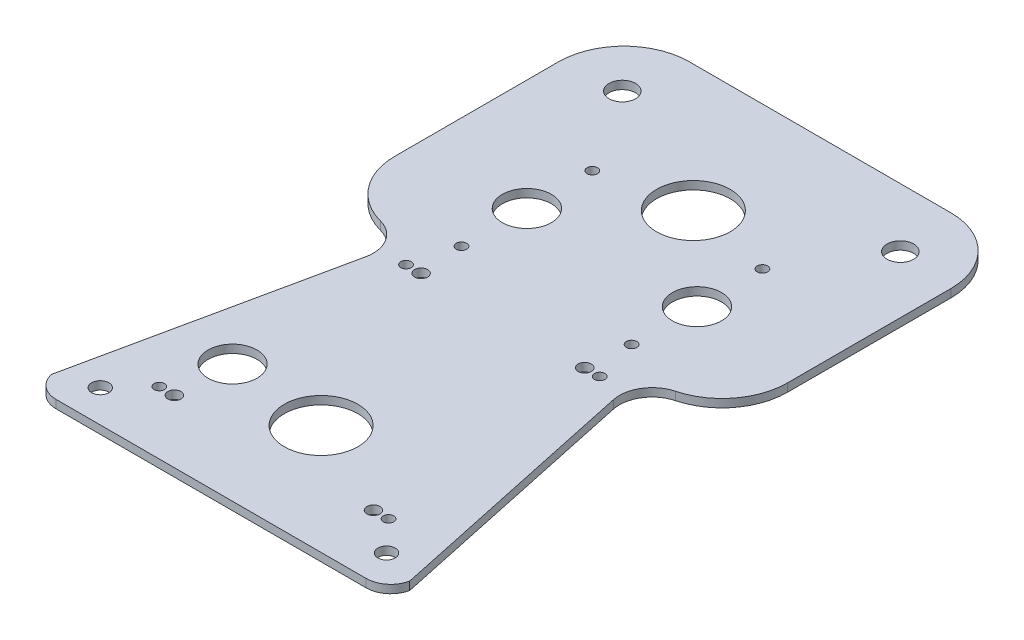
from build123d import *

# Parameters (mm, degrees)
SKETCH1_W                  = 355.6
SKETCH1_H                  = 77.724
BOSS_EXTRUDE1_DEPTH        = 22.225
SKETCH2_W                  = 74.549
SKETCH2_H                  = 19.05
CUT_EXTRUDE1_DEPTH         = 364.67400769
SKETCH3_W                  = 25.4
SKETCH3_H                  = 3.937
CUT_EXTRUDE2_DEPTH         = 817.444922817
SKETCH4_W                  = 330.2
SKETCH4_H                  = 3.175
BOSS_EXTRUDE2_DEPTH        = 15.875
SKETCH5_W                  = 69.85
SKETCH5_H                  = 3.175
BOSS_EXTRUDE3_DEPTH        = 457.2
SKETCH6_W                  = 330.2
SKETCH6_H                  = 3.175
BOSS_EXTRUDE4_DEPTH        = 3.937
SKETCH7_W                  = 330.2
SKETCH7_H                  = 3.175
BOSS_EXTRUDE5_DEPTH        = 15.875
SKETCH8_W                  = 355.6
SKETCH8_H                  = 3.175
BOSS_EXTRUDE6_DEPTH        = 3.937
SKETCH9_W                  = 355.6
SKETCH9_H                  = 3.175
BOSS_EXTRUDE7_DEPTH        = 19.05
SKETCH10_W                 = 76.358809824
SKETCH10_H                 = 3.175
BOSS_EXTRUDE8_DEPTH        = 27.432
SKETCH11_W                 = 124.052954744
SKETCH11_H                 = 3.175
BOSS_EXTRUDE9_DEPTH        = 19.05
DRAFT1_ANGLE               = 30
DRAFT2_ANGLE               = 19
M20_CLEARANCE_HOLE1_D      = 22.225
M20_CLEARANCE_HOLE1_DEPTH  = 19.050025
HOLE1_D                    = 8.128
HOLE1_DEPTH                = 22.225
M25_CLEARANCE_HOLE1_D      = 28.575
M25_CLEARANCE_HOLE1_DEPTH  = 22.225
M3_CLEARANCE_HOLE1_D       = 3.571875
M3_CLEARANCE_HOLE1_DEPTH   = 22.225
M2_CLEARANCE_HOLE1_D       = 2.54
M2_CLEARANCE_HOLE1_DEPTH   = 22.225
M3_5_CLEARANCE_HOLE1_D     = 4.064
M3_5_CLEARANCE_HOLE1_DEPTH = 22.225
HOLE2_D                    = 5.08
HOLE2_DEPTH                = 22.225
M25_CLEARANCE_HOLE2_D      = 28.575
M25_CLEARANCE_HOLE2_DEPTH  = 19.050025
HOLE3_D                    = 5.1054
HOLE3_DEPTH                = 19.050025
HOLE4_D                    = 8.128
HOLE4_DEPTH                = 19.050025
M3_CLEARANCE_HOLE2_D       = 3.571875
M3_CLEARANCE_HOLE2_DEPTH   = 19.050025
M6_CLEARANCE_HOLE1_D       = 6.7056
M6_CLEARANCE_HOLE1_DEPTH   = 22.225
M6_CLEARANCE_HOLE2_D       = 6.7056
M6_CLEARANCE_HOLE2_DEPTH   = 101.219
M5_CLEARANCE_HOLE1_D       = 5.334
M5_CLEARANCE_HOLE1_DEPTH   = 92.837
CHAMFER1_SIZE              = 3.175
FILLET1_R                  = 0.762
FILLET2_R                  = 3.175
FILLET3_R                  = 3.937
CUT_EXTRUDE3_DEPTH         = 819.902667079
CUT_EXTRUDE3_DEPTH_BACK    = 819.902667079
BOSS_EXTRUDE10_DEPTH       = 3.175
BOSS_EXTRUDE11_DEPTH       = 3.175
FILLET4_R                  = 25.4
FILLET5_R                  = 12.7
SKETCH47_R                 = 14.2875
SKETCH47_R_2               = 8.5
SKETCH47_R_3               = 9.525
SKETCH47_R_4               = 2.032
CUT_EXTRUDE4_DEPTH         = 527.736643419
SKETCH49_R                 = 9.5
CUT_EXTRUDE12_DEPTH        = 12.7
SKETCH58_R                 = 5.159375
CUT_EXTRUDE14_DEPTH        = 527.736643419


with BuildPart() as part:
    # Sketch1 → Boss-Extrude1 (new body)
    with BuildSketch(Plane(origin=(0, 3.175, 0), x_dir=(1, 0, 0), z_dir=(0, 1, 0))):
        with Locations((635, 34.925)):
            Rectangle(SKETCH1_W, SKETCH1_H)
    extrude(amount=-BOSS_EXTRUDE1_DEPTH)

    # Sketch2 → Cut-Extrude1 (cut, through all)
    with BuildSketch(Plane(origin=(812.8, 0, 0), x_dir=(0, 0, -1), z_dir=(1, 0, 0))):
        with Locations((33.3375, -9.525)):
            Rectangle(SKETCH2_W, SKETCH2_H)
    extrude(amount=-CUT_EXTRUDE1_DEPTH, mode=Mode.SUBTRACT)

    # Sketch3 → Cut-Extrude2 (cut, through all)
    with BuildSketch(Plane(origin=(0, 3.175, 0), x_dir=(-1, 0, 0), z_dir=(0, 1, 0))):
        with Locations((-469.9, 1.9685)):
            Rectangle(SKETCH3_W, SKETCH3_H)
    extrude(amount=-CUT_EXTRUDE2_DEPTH, mode=Mode.SUBTRACT)

    # Sketch4 → Boss-Extrude2 (add)
    with BuildSketch(Plane(origin=(0, 3.175, 0), x_dir=(-1, 0, 0), z_dir=(0, 1, 0))):
        with Locations((-647.7, 2.3495)):
            Rectangle(SKETCH4_W, SKETCH4_H)
    extrude(amount=BOSS_EXTRUDE2_DEPTH)

    # Sketch5 → Boss-Extrude3 (add)
    with BuildSketch(Plane.ZY.offset(-457.2)):
        with Locations((-34.925, 1.5875)):
            Rectangle(SKETCH5_W, SKETCH5_H)
    extrude(amount=BOSS_EXTRUDE3_DEPTH)

    # Sketch6 → Boss-Extrude4 (add)
    with BuildSketch(Plane.XY):
        with Locations((165.1, 1.5875)):
            Rectangle(SKETCH6_W, SKETCH6_H)
    extrude(amount=BOSS_EXTRUDE4_DEPTH)

    # Sketch7 → Boss-Extrude5 (add)
    with BuildSketch(Plane(origin=(0, 3.175, 0), x_dir=(-1, 0, 0), z_dir=(0, 1, 0))):
        with Locations((-165.1, 2.3495)):
            Rectangle(SKETCH7_W, SKETCH7_H)
    extrude(amount=BOSS_EXTRUDE5_DEPTH)

    # Sketch8 → Boss-Extrude6 (add)
    with BuildSketch(Plane(origin=(0, 0, -69.85), x_dir=(-1, 0, 0), z_dir=(0, 0, -1))):
        with Locations((-177.8, 1.5875)):
            Rectangle(SKETCH8_W, SKETCH8_H)
    extrude(amount=BOSS_EXTRUDE6_DEPTH)

    # Sketch9 → Boss-Extrude7 (add)
    with BuildSketch(Plane.XZ):
        with Locations((177.8, -72.1995)):
            Rectangle(SKETCH9_W, SKETCH9_H)
    extrude(amount=BOSS_EXTRUDE7_DEPTH)

    # Sketch10 → Boss-Extrude8 (add)
    with BuildSketch(Plane(origin=(0, 0, -69.85), x_dir=(-1, 0, 0), z_dir=(0, 0, -1))):
        with Locations((-406.4, 1.5875)):
            Rectangle(SKETCH10_W, SKETCH10_H)
    extrude(amount=BOSS_EXTRUDE8_DEPTH)

    # Sketch11 → Boss-Extrude9 (add)
    with BuildSketch(Plane.XY):
        with Locations((406.4, 1.5875)):
            Rectangle(SKETCH11_W, SKETCH11_H)
    extrude(amount=BOSS_EXTRUDE9_DEPTH)

    # Draft1
    draft1_faces = [part.faces().sort_by_distance(p)[0] for p in [
        (344.373522628, 1.5875, 9.525),
        (468.426477372, 1.5875, 9.525),
    ]]
    draft(draft1_faces, Plane.XY.offset(19.05), DRAFT1_ANGLE)

    # Draft2
    draft2_faces = [part.faces().sort_by_distance(p)[0] for p in [
        (368.220595088, 1.5875, -83.566),
        (444.579404912, 1.5875, -83.566),
    ]]
    draft(draft2_faces, Plane(origin=(0, 0, -97.282), x_dir=(-1, 0, 0), z_dir=(0, 0, -1)), DRAFT2_ANGLE)

    # M20 Clearance Hole1
    with Locations(Plane(origin=(0, 0, 0), x_dir=(-1, 0, 0), z_dir=(0, -1, 0))):
        with Locations((-624.254637168, 36.83)):
            Hole(M20_CLEARANCE_HOLE1_D / 2, depth=M20_CLEARANCE_HOLE1_DEPTH)

    # Hole1
    with Locations(Plane(origin=(0, 3.175, 0), x_dir=(1, 0, 0), z_dir=(0, 1, 0))):
        with Locations((229.261562832, 36.83), (229.261562832, 62.23), (229.261562832, 11.43)):
            Hole(HOLE1_D / 2, depth=HOLE1_DEPTH)

    # M25 Clearance Hole1
    with Locations(Plane(origin=(0, 3.175, 0), x_dir=(1, 0, 0), z_dir=(0, 1, 0))):
        with Locations((147.829162832, 36.83)):
            Hole(M25_CLEARANCE_HOLE1_D / 2, depth=M25_CLEARANCE_HOLE1_DEPTH)

    # M3 Clearance Hole1
    with Locations(Plane(origin=(0, 3.175, 0), x_dir=(1, 0, 0), z_dir=(0, 1, 0))):
        with Locations((120.600362832, 65.405), (120.600362832, 8.255), (237.440362832, 8.255), (237.440362832, 65.405)):
            Hole(M3_CLEARANCE_HOLE1_D / 2, depth=M3_CLEARANCE_HOLE1_DEPTH)

    # M2 Clearance Hole1
    with Locations(Plane(origin=(0, 3.175, 0), x_dir=(1, 0, 0), z_dir=(0, 1, 0))):
        with Locations((101.6, 3.175), (101.6, 66.675), (50.8, 66.675), (50.8, 3.175), (762, 66.675), (762, 3.175), (711.2, 3.175), (711.2, 66.675)):
            Hole(M2_CLEARANCE_HOLE1_D / 2, depth=M2_CLEARANCE_HOLE1_DEPTH)

    # M3.5 Clearance Hole1
    with Locations(Plane(origin=(0, 3.175, 0), x_dir=(1, 0, 0), z_dir=(0, 1, 0))):
        with Locations((443.992, 87.85352), (368.808, 87.85352), (361.9119, -1.03886), (450.8881, -1.03886)):
            Hole(M3_5_CLEARANCE_HOLE1_D / 2, depth=M3_5_CLEARANCE_HOLE1_DEPTH)

    # Hole2
    with Locations(Plane(origin=(0, 3.175, 0), x_dir=(1, 0, 0), z_dir=(0, 1, 0))):
        with Locations((438.15, 87.85352), (374.65, 87.85352), (445.0461, -1.03886), (367.7539, -1.03886), (115.520362832, 65.405), (115.520362832, 8.255), (242.520362832, 8.255), (242.520362832, 65.405)):
            Hole(HOLE2_D / 2, depth=HOLE2_DEPTH)

    # M25 Clearance Hole2
    with Locations(Plane(origin=(0, 0, 0), x_dir=(-1, 0, 0), z_dir=(0, -1, 0))):
        with Locations((-406.4, 17.272), (-664.970837168, 36.83)):
            Hole(M25_CLEARANCE_HOLE2_D / 2, depth=M25_CLEARANCE_HOLE2_DEPTH)

    # Hole3
    with Locations(Plane(origin=(0, 0, 0), x_dir=(-1, 0, 0), z_dir=(0, -1, 0))):
        with Locations((-570.279637168, 8.255), (-570.279637168, 65.405), (-697.279637168, 65.405), (-697.279637168, 8.255)):
            Hole(HOLE3_D / 2, depth=HOLE3_DEPTH)

    # Hole4
    with Locations(Plane(origin=(0, 0, 0), x_dir=(-1, 0, 0), z_dir=(0, -1, 0))):
        with Locations((-583.538437168, 11.43), (-583.538437168, 36.83), (-583.538437168, 62.23)):
            Hole(HOLE4_D / 2, depth=HOLE4_DEPTH)

    # M3 Clearance Hole2
    with Locations(Plane(origin=(0, 0, 0), x_dir=(-1, 0, 0), z_dir=(0, -1, 0))):
        with Locations((-692.199637168, 8.255), (-692.199637168, 65.405), (-575.359637168, 65.405), (-575.359637168, 8.255)):
            Hole(M3_CLEARANCE_HOLE2_D / 2, depth=M3_CLEARANCE_HOLE2_DEPTH)

    # M6 Clearance Hole1
    with Locations(Plane(origin=(0, 3.175, 0), x_dir=(1, 0, 0), z_dir=(0, 1, 0))):
        with Locations((612.775, 10.287), (498.475, 10.287), (314.325, 10.287), (200.025, 10.287), (628.319218584, 61.976), (184.480781416, 61.976), (690.88, 15.875), (739.902, 9.525), (121.92, 15.875), (72.898, 9.525), (298.874532383, 17.547282407), (513.925467617, 17.547282407), (165.1, 14.732), (266.7, 14.732), (546.1, 14.732), (647.7, 14.732), (330.2, 61.722), (279.4, 61.722), (139.7, 61.722), (25.4, 61.722), (482.6, 61.722), (533.4, 61.722), (673.1, 61.722), (787.4, 61.722), (6.35, 39.497), (806.45, 39.497), (350.8375, -12.8905), (461.9625, -12.8905)):
            Hole(M6_CLEARANCE_HOLE1_D / 2, depth=M6_CLEARANCE_HOLE1_DEPTH)

    # M6 Clearance Hole2
    with Locations(Plane.XY.offset(3.937)):
        with Locations((495.3, 12.7), (520.7, 12.7), (546.1, 12.7), (571.5, 12.7), (596.9, 12.7), (622.3, 12.7), (647.7, 12.7), (673.1, 12.7), (698.5, 12.7), (723.9, 12.7), (749.3, 12.7), (774.7, 12.7), (800.1, 12.7), (317.5, 12.7), (292.1, 12.7), (266.7, 12.7), (241.3, 12.7), (215.9, 12.7), (190.5, 12.7), (165.1, 12.7), (139.7, 12.7), (114.3, 12.7), (88.9, 12.7), (63.5, 12.7), (12.7, 12.7), (38.1, 12.7)):
            Hole(M6_CLEARANCE_HOLE2_D / 2, depth=M6_CLEARANCE_HOLE2_DEPTH)

    # M5 Clearance Hole1
    with Locations(Plane(origin=(0, 0, -73.787), x_dir=(-1, 0, 0), z_dir=(0, 0, -1))):
        with Locations((-469.9, -12.7), (-495.3, -12.7), (-520.7, -12.7), (-546.1, -12.7), (-571.5, -12.7), (-596.9, -12.7), (-622.3, -12.7), (-647.7, -12.7), (-673.1, -12.7), (-698.5, -12.7), (-723.9, -12.7), (-749.3, -12.7), (-774.7, -12.7), (-800.1, -12.7), (-342.9, -12.7), (-317.5, -12.7), (-292.1, -12.7), (-266.7, -12.7), (-241.3, -12.7), (-215.9, -12.7), (-190.5, -12.7), (-165.1, -12.7), (-139.7, -12.7), (-114.3, -12.7), (-88.9, -12.7), (-63.5, -12.7), (-38.1, -12.7), (-12.7, -12.7)):
            Hole(M5_CLEARANCE_HOLE1_D / 2, depth=M5_CLEARANCE_HOLE1_DEPTH)

    # Chamfer1
    chamfer1_edges = [part.edges().sort_by_distance(p)[0] for p in [
        (482.6, 19.05, 2.3495),
        (0, 19.05, 2.3495),
        (812.8, 19.05, 2.3495),
        (812.8, -19.05, -72.1995),
        (457.2, -19.05, -72.1995),
        (0, -19.05, -72.1995),
        (330.2, 19.05, 2.3495),
        (355.6, -19.05, -72.1995),
    ]]
    chamfer(chamfer1_edges, length=CHAMFER1_SIZE)

    # Fillet1
    fillet1_edges = [part.edges().sort_by_distance(p)[0] for p in [
        (647.7, 3.175, 0.762),
        (177.8, 0, -70.612),
        (635, 0, -70.612),
        (165.1, 3.175, 0.762),
    ]]
    fillet(fillet1_edges, radius=FILLET1_R)

    # Fillet2
    fillet2_edges = [part.edges().sort_by_distance(p)[0] for p in [
        (368.220595088, 1.5875, -97.282),
        (333.375, 1.5875, 0),
        (344.373522628, 1.5875, 19.05),
        (444.579404912, 1.5875, -97.282),
        (358.775, 1.5875, -69.85),
        (479.425, 1.5875, 0),
        (468.426477372, 1.5875, 19.05),
        (454.025, 1.5875, -69.85),
    ]]
    fillet(fillet2_edges, radius=FILLET2_R)

    # Fillet3
    fillet3_edges = [part.edges().sort_by_distance(p)[0] for p in [
        (165.1, 0, 3.937),
        (647.7, 0, 3.937),
        (635, 3.175, -73.787),
        (177.8, 3.175, -73.787),
    ]]
    fillet(fillet3_edges, radius=FILLET3_R)

    # Sketch44 → Cut-Extrude3 (cut, two sides: drawn at the far end of the back side and taken through both)
    with BuildSketch(Plane(origin=(0, 3.175, 0), x_dir=(1, 0, 0), z_dir=(0, 1, 0)).offset(-CUT_EXTRUDE3_DEPTH_BACK)):
        Polygon((367.483279101, 95.14067889), (343.456979076, -17.4625), (339.564298226, -35.70618453), (-19.786749283, -35.70618453), (-19.786749283, 120.609234526), (367.483279101, 120.609234526), align=None)
        Polygon((445.316720899, 95.14067889), (445.316720899, 120.609234526), (832.586749283, 120.609234526), (832.586749283, -35.70618453), (473.235701774, -35.70618453), (469.343020924, -17.4625), align=None)
    extrude(amount=CUT_EXTRUDE3_DEPTH + CUT_EXTRUDE3_DEPTH_BACK, mode=Mode.SUBTRACT)

    # Sketch45 → Boss-Extrude10 (add)
    with BuildSketch(Plane(origin=(0, 3.175, 0), x_dir=(1, 0, 0), z_dir=(0, 1, 0))):
        with BuildLine():
            Line((346.206609733, -25.4), (466.593390267, -25.4))
            ThreePointArc((466.593390267, -25.4), (472.596584658, -23.270084997), (475.914992949, -17.832893882))
            Line((475.914992949, -17.832893882), (451.468023216, 96.741822292))
            ThreePointArc((451.468023216, 96.741822292), (448.04309111, 101.716937823), (442.314699422, 103.632))
            Line((442.314699422, 103.632), (370.485300578, 103.632))
            ThreePointArc((370.485300578, 103.632), (364.75690889, 101.716937823), (361.331976784, 96.741822292))
            Line((361.331976784, 96.741822292), (336.885007051, -17.832893882))
            ThreePointArc((336.885007051, -17.832893882), (340.203415342, -23.270084997), (346.206609733, -25.4))
        make_face()
        with BuildLine():
            Line((343.456979076, -17.4625), (367.483279101, 95.14067889))
            ThreePointArc((367.483279101, 95.14067889), (368.641568694, 96.691816771), (370.485300578, 97.282))
            Line((370.485300578, 97.282), (442.314699422, 97.282))
            ThreePointArc((442.314699422, 97.282), (444.158431306, 96.691816771), (445.316720899, 95.14067889))
            Line((445.316720899, 95.14067889), (469.343020924, -17.4625))
            ThreePointArc((469.343020924, -17.4625), (468.180890267, -18.624630657), (466.593390267, -19.05))
            Line((466.593390267, -19.05), (346.206609733, -19.05))
            ThreePointArc((346.206609733, -19.05), (344.619109733, -18.624630657), (343.456979076, -17.4625))
        make_face(mode=Mode.SUBTRACT)
    extrude(amount=-BOSS_EXTRUDE10_DEPTH)

    # Sketch46 → Boss-Extrude11 (add)
    with BuildSketch(Plane(origin=(0, 3.175, 0), x_dir=(1, 0, 0), z_dir=(0, 1, 0))):
        with BuildLine():
            Line((361.331976784, 96.741822292), (330.2, 96.741822292))
            Line((330.2, 96.741822292), (330.2, 211.041822292))
            Line((330.2, 211.041822292), (482.6, 211.041822292))
            Line((482.6, 211.041822292), (482.6, 96.741822292))
            Line((482.6, 96.741822292), (451.468023216, 96.741822292))
            ThreePointArc((451.468023216, 96.741822292), (448.04309111, 101.716937823), (442.314699422, 103.632))
            Line((442.314699422, 103.632), (370.485300578, 103.632))
            ThreePointArc((370.485300578, 103.632), (364.75690889, 101.716937823), (361.331976784, 96.741822292))
        make_face()
    extrude(amount=-BOSS_EXTRUDE11_DEPTH)

    # Fillet4
    fillet4_edges = [part.edges().sort_by_distance(p)[0] for p in [
        (482.6, 1.5875, -96.741822292),
        (482.6, 1.5875, -211.041822292),
        (330.2, 1.5875, -211.041822292),
        (330.2, 1.5875, -96.741822292),
    ]]
    fillet(fillet4_edges, radius=FILLET4_R)

    # Fillet5
    fillet5_edges = [part.edges().sort_by_distance(p)[0] for p in [
        (361.331976784, 1.5875, -96.741822292),
        (451.468023216, 1.5875, -96.741822292),
    ]]
    fillet(fillet5_edges, radius=FILLET5_R)

    # Sketch47 → Cut-Extrude4 (cut, through all)
    with BuildSketch(Plane(origin=(0, 3.175, 0), x_dir=(1, 0, 0), z_dir=(0, 1, 0))):
        with Locations(Location((406.4, 161.801999542, 0), (0, 0, 270))):
            Circle(SKETCH47_R)
        with Locations(Location((368.558536254, 20.739509412, 0), (0, 0, 270))):
            Circle(SKETCH47_R_2)
        with Locations(Location((439.42, 130.179254563, 0), (0, 0, 270))):
            Circle(SKETCH47_R_3)
        with Locations(Location((373.38, 130.179254563, 0), (0, 0, 270))):
            Circle(SKETCH47_R_3)
        with Locations(Location((373.38, 155.579254563, 0), (0, 0, 270))):
            Circle(SKETCH47_R_4)
        with Locations(Location((373.38, 104.779254563, 0), (0, 0, 270))):
            Circle(SKETCH47_R_4)
        with Locations(Location((439.42, 155.579254563, 0), (0, 0, 270))):
            Circle(SKETCH47_R_4)
        with Locations(Location((439.42, 104.779254563, 0), (0, 0, 270))):
            Circle(SKETCH47_R_4)
    extrude(amount=-CUT_EXTRUDE4_DEPTH, mode=Mode.SUBTRACT)

    # Sketch49 → Cut-Extrude12 (cut)
    with BuildSketch(Plane(origin=(0, 3.175, 0), x_dir=(1, 0, 0), z_dir=(0, 1, 0))):
        with Locations(Location((368.558536254, 20.739509412, 0), (0, 0, 270))):
            Circle(SKETCH49_R)
    extrude(amount=-CUT_EXTRUDE12_DEPTH, mode=Mode.SUBTRACT)

    # Sketch58 → Cut-Extrude14 (cut, through all)
    with BuildSketch(Plane(origin=(0, 3.175, 0), x_dir=(1, 0, 0), z_dir=(0, 1, 0))):
        with Locations(Location((352.425, 188.181822292, 0), (0, 0, 270))):
            Circle(SKETCH58_R)
        with Locations(Location((460.375, 188.181822292, 0), (0, 0, 270))):
            Circle(SKETCH58_R)
    extrude(amount=-CUT_EXTRUDE14_DEPTH, mode=Mode.SUBTRACT)


solid = part.part
